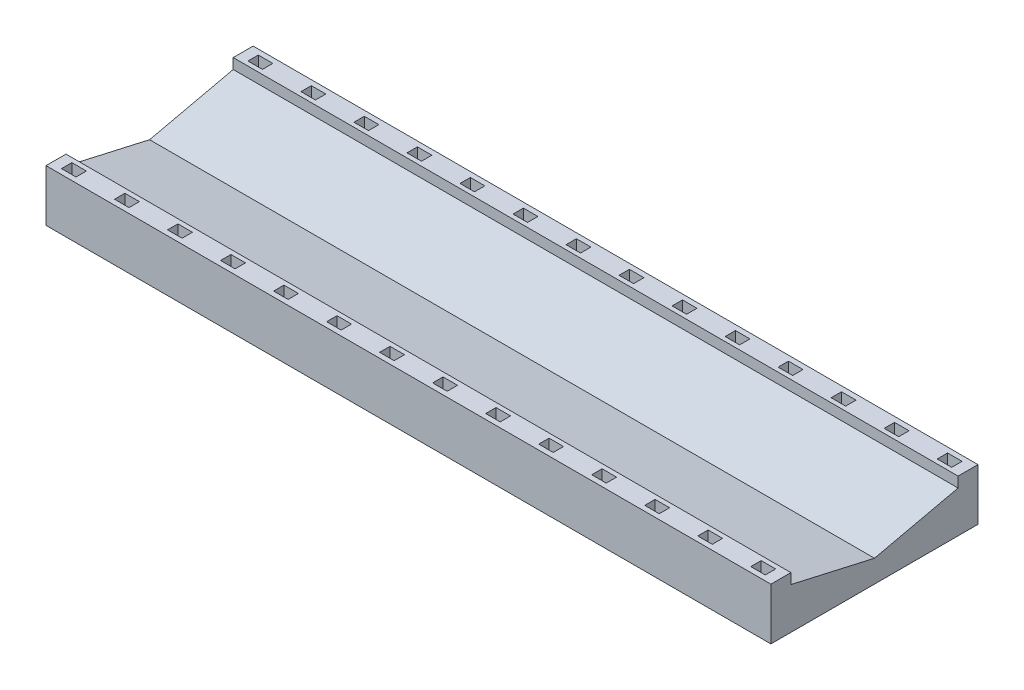
from build123d import *

# Parameters (mm, degrees)
SKETCH2_W               = 35
SKETCH2_H               = 10
BOSS_EXTRUDE1_DEPTH     = 2.5
SKETCH3_W               = 0.7
SKETCH3_H               = 0.5
CUT_EXTRUDE1_DEPTH      = 2
LPATTERN1_COUNT         = 14
LPATTERN1_PITCH         = 2.56
LPATTERN1_COUNT_DIR2    = 2
LPATTERN1_PITCH_DIR2    = 9
CUT_EXTRUDE2_DEPTH      = 37.486298798
CUT_EXTRUDE2_DEPTH_BACK = 37.486298798


with BuildPart() as part:
    # Sketch2 → Boss-Extrude1 (new body)
    with BuildSketch(Plane(origin=(0, 0, 0), x_dir=(1, 0, 0), z_dir=(0, 1, 0))):
        with Locations((17.5, 5)):
            Rectangle(SKETCH2_W, SKETCH2_H)
    extrude(amount=BOSS_EXTRUDE1_DEPTH)

    # Sketch3 → Cut-Extrude1 (cut)
    with BuildSketch(Plane(origin=(0, 2.5, 0), x_dir=(1, 0, 0), z_dir=(0, 1, 0))):
        with Locations((0.85, 0.5)):
            Rectangle(SKETCH3_W, SKETCH3_H)
    cut_extrude1 = extrude(amount=-CUT_EXTRUDE1_DEPTH, mode=Mode.SUBTRACT)

    # LPattern1: Cut-Extrude1 14 × 2
    with Locations(*[(i * LPATTERN1_PITCH, 0, -j * LPATTERN1_PITCH_DIR2) for i in range(LPATTERN1_COUNT) for j in range(LPATTERN1_COUNT_DIR2) if (i, j) != (0, 0)]):
        add(cut_extrude1, mode=Mode.SUBTRACT)

    # Sketch4 → Cut-Extrude2 (cut, two sides: drawn at the far end of the back side and taken through both)
    with BuildSketch(Plane.ZY.offset(-CUT_EXTRUDE2_DEPTH_BACK)):
        Polygon((-9.038587053, 31.255911699), (-9.038587053, 2.5), (-9.038587053, 2), (-5.001909552, 1.083533753), (-0.965232052, 2), (-0.965232052, 2.5), (-0.965232052, 31.255911699), (-0.965232052, 88.767735096), (-9.038587053, 88.767735096), align=None)
    extrude(amount=CUT_EXTRUDE2_DEPTH + CUT_EXTRUDE2_DEPTH_BACK, mode=Mode.SUBTRACT)


solid = part.part
